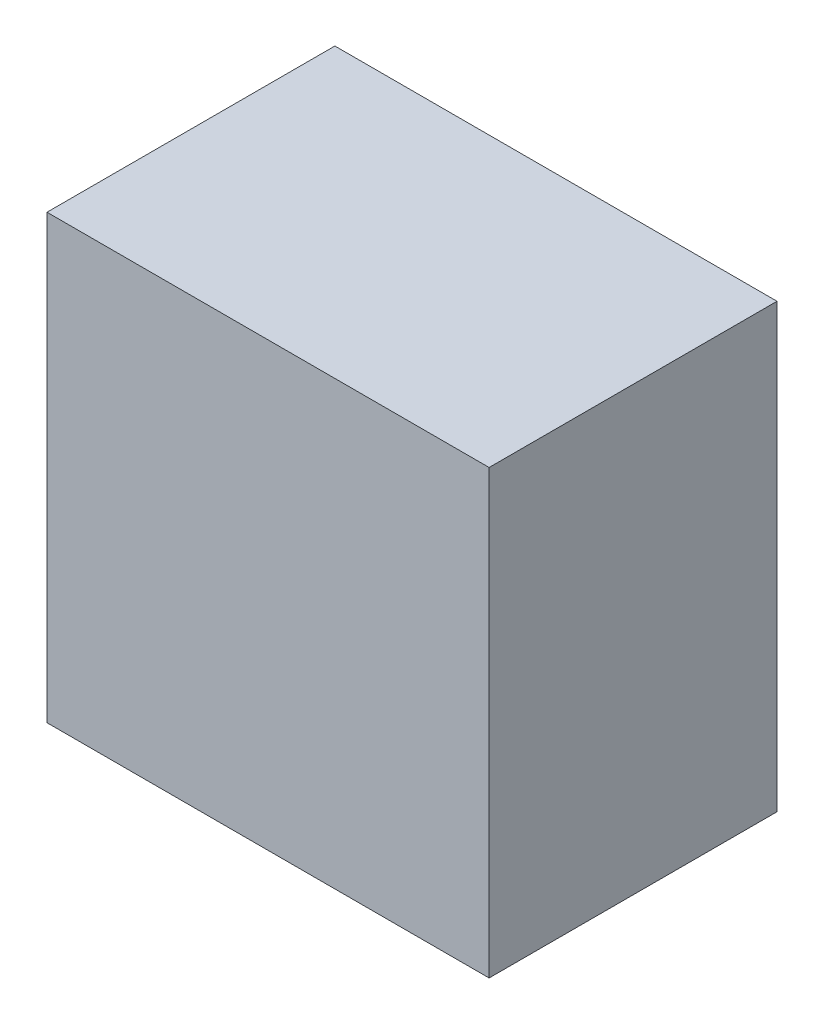
from build123d import *

# Parameters (mm, degrees)
SKETCH_1_W          = 43
SKETCH_1_H          = 43
EXTRUDE_1_DEPTH     = 28
SKETCH_2_R          = 4.05
CUT_EXTRUDE_1_DEPTH = 12


with BuildPart() as part:
    # Эскиз1 → Бобышка-Вытянуть1 (new body)
    with BuildSketch(Plane.XY):
        Rectangle(SKETCH_1_W, SKETCH_1_H)
    extrude(amount=EXTRUDE_1_DEPTH)

    # Эскиз2 → Вырез-Вытянуть1 (cut)
    with BuildSketch(Plane(origin=(0, 0, 0), x_dir=(-1, 0, 0), z_dir=(0, 0, -1))):
        Circle(SKETCH_2_R)
    extrude(amount=-CUT_EXTRUDE_1_DEPTH, mode=Mode.SUBTRACT)


solid = part.part
